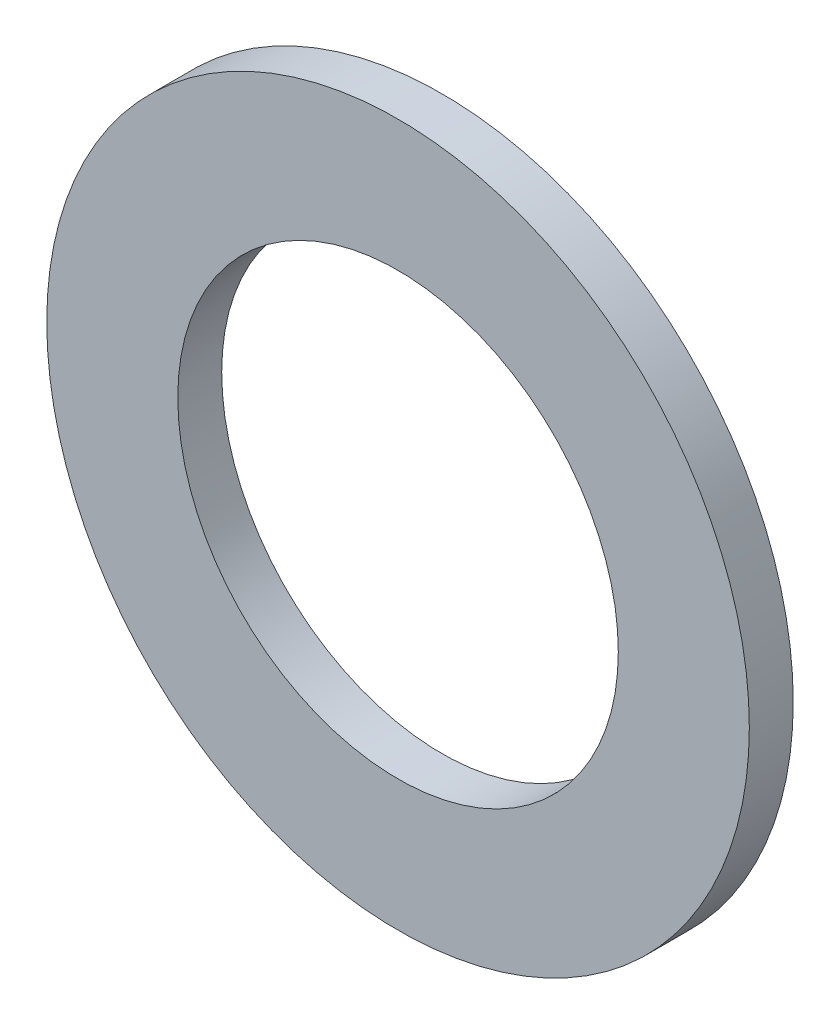
from build123d import *

# Parameters (mm, degrees)
SKETCH1_R      = 12.7
SKETCH1_R_2    = 7.9629
EXTRUDE1_DEPTH = 0.79375


with BuildPart() as part:
    # Sketch1 → Extrude1 (new, symmetric)
    with BuildSketch(Plane.XY):
        Circle(SKETCH1_R)
        Circle(SKETCH1_R_2, mode=Mode.SUBTRACT)
    extrude(amount=EXTRUDE1_DEPTH, both=True)


solid = part.part
